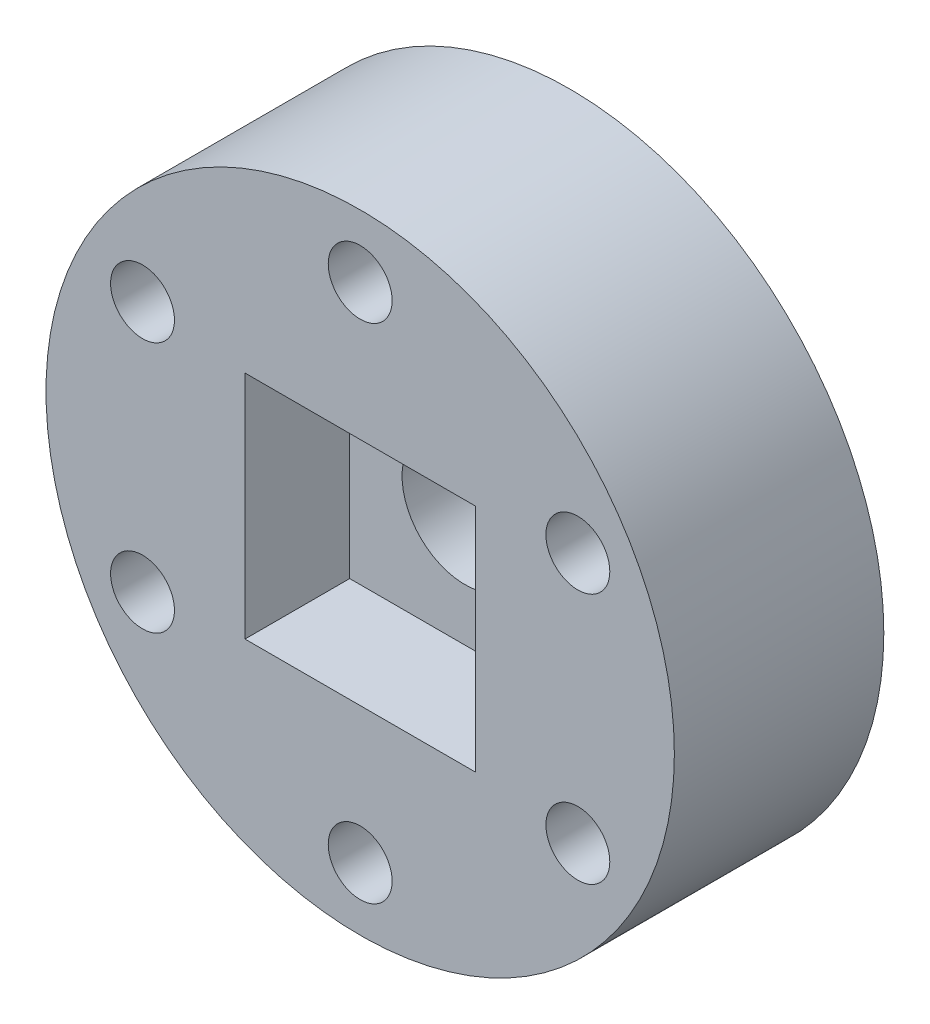
from build123d import *

# Parameters (mm, degrees)
SKETCH_1_R          = 30
SKETCH_1_R_2        = 3.05
SKETCH_1_R_3        = 6
EXTRUDE_1_DEPTH     = 20
SKETCH_2_W          = 22
SKETCH_2_H          = 22
CUT_EXTRUDE_1_DEPTH = 10
SKETCH_3_R          = 5.95
CUT_EXTRUDE_6_DEPTH = 10


with BuildPart() as part:
    # Эскиз1 → Бобышка-Вытянуть1 (new body)
    with BuildSketch(Plane.XY):
        Circle(SKETCH_1_R)
        with Locations((0, 24)):
            Circle(SKETCH_1_R_2, mode=Mode.SUBTRACT)
        with Locations((20.784609691, 12)):
            Circle(SKETCH_1_R_2, mode=Mode.SUBTRACT)
        with Locations((20.784609691, -12)):
            Circle(SKETCH_1_R_2, mode=Mode.SUBTRACT)
        with Locations((0, -24)):
            Circle(SKETCH_1_R_2, mode=Mode.SUBTRACT)
        with Locations((-20.784609691, -12)):
            Circle(SKETCH_1_R_2, mode=Mode.SUBTRACT)
        with Locations((-20.784609691, 12)):
            Circle(SKETCH_1_R_2, mode=Mode.SUBTRACT)
        Circle(SKETCH_1_R_3, mode=Mode.SUBTRACT)
    extrude(amount=EXTRUDE_1_DEPTH)

    # Эскиз2 → Вырез-Вытянуть1 (cut)
    with BuildSketch(Plane.XY.offset(20)):
        Rectangle(SKETCH_2_W, SKETCH_2_H)
    extrude(amount=-CUT_EXTRUDE_1_DEPTH, mode=Mode.SUBTRACT)

    # Эскиз3 → Вырез-Вытянуть6 (cut)
    with BuildSketch(Plane(origin=(0, 0, 0), x_dir=(-1, 0, 0), z_dir=(0, 0, -1))):
        with Locations((0, 24)):
            Circle(SKETCH_3_R)
        with Locations((20.784609691, 12)):
            Circle(SKETCH_3_R)
        with Locations((20.784609691, -12)):
            Circle(SKETCH_3_R)
        with Locations((0, -24)):
            Circle(SKETCH_3_R)
        with Locations((-20.784609691, -12)):
            Circle(SKETCH_3_R)
        with Locations((-20.784609691, 12)):
            Circle(SKETCH_3_R)
    extrude(amount=-CUT_EXTRUDE_6_DEPTH, mode=Mode.SUBTRACT)


solid = part.part
